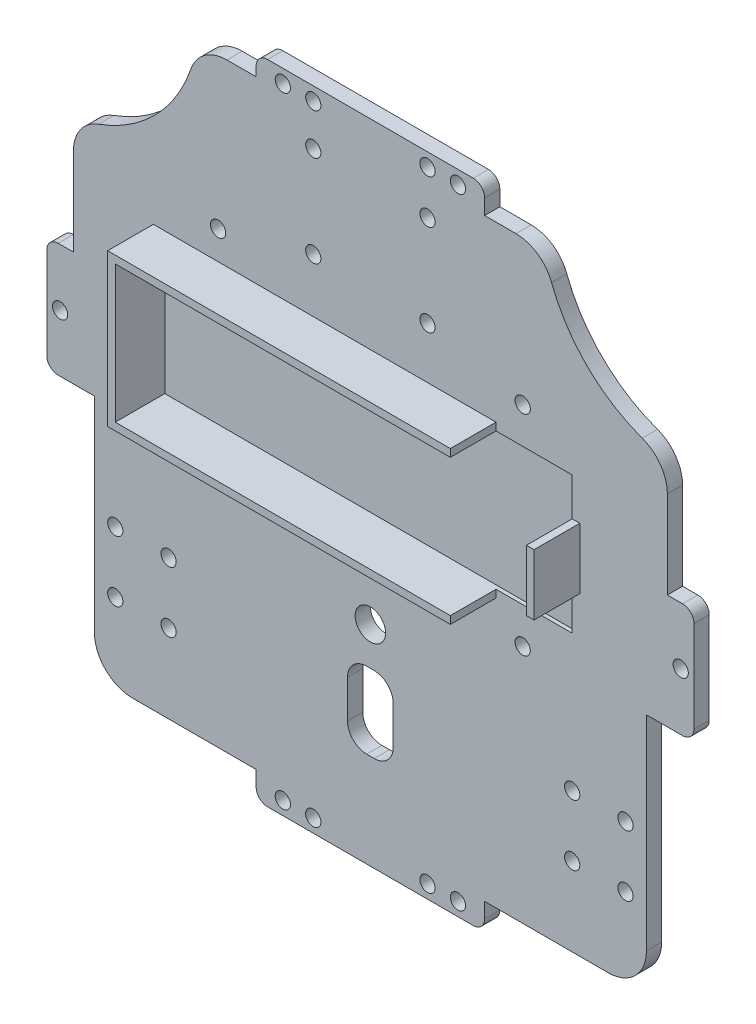
from build123d import *

# Parameters (mm, degrees)
BOSS_EXTRUDE1_DEPTH = 4
SKETCH2_R           = 2
SKETCH2_R_2         = 4
CUT_EXTRUDE1_DEPTH  = 5
BOSS_EXTRUDE2_DEPTH = 12
SKETCH5_W           = 108
SKETCH5_H           = 36
CUT_EXTRUDE3_DEPTH  = 13


with BuildPart() as part:
    # Sketch1 → Boss-Extrude1 (new body)
    with BuildSketch(Plane.XY):
        with BuildLine():
            Line((82, 15), (78, 15))
            Line((78, 15), (78, 37.978728218))
            ThreePointArc((78, 37.978728218), (76.185352772, 43.723290865), (71.4, 47.382982574))
            ThreePointArc((71.4, 47.382982574), (56.923524203, 56.509448815), (47.586109287, 70.850767451))
            ThreePointArc((47.586109287, 70.850767451), (43.91712949, 75.540642349), (38.232636609, 77.313459314))
            Line((38.232636609, 77.313459314), (30, 77.313459314))
            Line((30, 77.313459314), (30, 81.313459314))
            ThreePointArc((30, 81.313459314), (29.121320344, 83.434779658), (27, 84.313459314))
            Line((27, 84.313459314), (-27, 84.313459314))
            ThreePointArc((-27, 84.313459314), (-29.121320344, 83.434779658), (-30, 81.313459314))
            Line((-30, 81.313459314), (-30, 78.861186474))
            Line((-30, 78.861186474), (-37.676235378, 78.861186474))
            ThreePointArc((-37.676235378, 78.861186474), (-43.495271937, 76.993763774), (-47.140988303, 72.08894918))
            ThreePointArc((-47.140988303, 72.08894918), (-56.458737454, 56.975076587), (-71.4, 47.382982574))
            ThreePointArc((-71.4, 47.382982574), (-76.185352772, 43.723290865), (-78, 37.978728218))
            Line((-78, 37.978728218), (-78, 15))
            Line((-78, 15), (-82, 15))
            ThreePointArc((-82, 15), (-84.121320344, 14.121320344), (-85, 12))
            Line((-85, 12), (-85, -12))
            ThreePointArc((-85, -12), (-84.121320344, -14.121320344), (-82, -15))
            Line((-82, -15), (-72.5, -15))
            Line((-72.5, -15), (-72.5, -68.686540686))
            ThreePointArc((-72.5, -68.686540686), (-69.571067812, -75.757608498), (-62.5, -78.686540686))
            Line((-62.5, -78.686540686), (-30, -78.686540686))
            Line((-30, -78.686540686), (-30, -82.686540686))
            ThreePointArc((-30, -82.686540686), (-29.121320344, -84.807861029), (-27, -85.686540686))
            Line((-27, -85.686540686), (27, -85.686540686))
            ThreePointArc((27, -85.686540686), (29.121320344, -84.807861029), (30, -82.686540686))
            Line((30, -82.686540686), (30, -78.686540686))
            Line((30, -78.686540686), (62.5, -78.686540686))
            ThreePointArc((62.5, -78.686540686), (69.571067812, -75.757608498), (72.5, -68.686540686))
            Line((72.5, -68.686540686), (72.5, -15))
            Line((72.5, -15), (82, -15))
            ThreePointArc((82, -15), (84.121320344, -14.121320344), (85, -12))
            Line((85, -12), (85, 12))
            ThreePointArc((85, 12), (84.121320344, 14.121320344), (82, 15))
        make_face()
    extrude(amount=BOSS_EXTRUDE1_DEPTH)

    # Sketch2 → Cut-Extrude1 (cut)
    with BuildSketch(Plane.XY.offset(4)):
        with Locations((81.5, 0)):
            Circle(SKETCH2_R)
        with Locations((-81.5, 0)):
            Circle(SKETCH2_R)
        with Locations((15, 80.813459314)):
            Circle(SKETCH2_R)
        with Locations((23, 80.813459314)):
            Circle(SKETCH2_R)
        with Locations((-23, 80.813459314)):
            Circle(SKETCH2_R)
        with Locations((-15, 80.813459314)):
            Circle(SKETCH2_R)
        with Locations((-23, -82.186540686)):
            Circle(SKETCH2_R)
        with Locations((-15, -82.186540686)):
            Circle(SKETCH2_R)
        with Locations((15, -82.186540686)):
            Circle(SKETCH2_R)
        with Locations((23, -82.186540686)):
            Circle(SKETCH2_R)
        with Locations((67, -42)):
            Circle(SKETCH2_R)
        with Locations((67, -58)):
            Circle(SKETCH2_R)
        with Locations((-40, -15.686540686)):
            Circle(SKETCH2_R)
        with Locations((40, -15.686540686)):
            Circle(SKETCH2_R)
        with Locations((40, 39.313459314)):
            Circle(SKETCH2_R)
        with Locations((-40, 39.313459314)):
            Circle(SKETCH2_R)
        with Locations((0, -30.686540686)):
            Circle(SKETCH2_R_2)
        with Locations((-15, 70.007888798)):
            Circle(SKETCH2_R)
        with Locations((15, 69.313459314)):
            Circle(SKETCH2_R)
        with Locations((-15, 46.007888798)):
            Circle(SKETCH2_R)
        with Locations((15, 45.313459314)):
            Circle(SKETCH2_R)
        with Locations((53, -58)):
            Circle(SKETCH2_R)
        with Locations((53, -42)):
            Circle(SKETCH2_R)
        with Locations((-53, -58)):
            Circle(SKETCH2_R)
        with Locations((-67, -58)):
            Circle(SKETCH2_R)
        with Locations((-67, -42)):
            Circle(SKETCH2_R)
        with Locations((-53, -42)):
            Circle(SKETCH2_R)
        with BuildLine():
            Line((-1, -40.686540686), (1, -40.686540686))
            ThreePointArc((1, -40.686540686), (4.535533906, -42.15100678), (6, -45.686540686))
            Line((6, -45.686540686), (6, -55.686540686))
            ThreePointArc((6, -55.686540686), (4.535533906, -59.222074592), (1, -60.686540686))
            Line((1, -60.686540686), (-1, -60.686540686))
            ThreePointArc((-1, -60.686540686), (-4.535533906, -59.222074592), (-6, -55.686540686))
            Line((-6, -55.686540686), (-6, -45.686540686))
            ThreePointArc((-6, -45.686540686), (-4.535533906, -42.15100678), (-1, -40.686540686))
        make_face()
    extrude(amount=-CUT_EXTRUDE1_DEPTH, mode=Mode.SUBTRACT)

    # Sketch3 → Boss-Extrude2 (add)
    with BuildSketch(Plane.XY.offset(4)):
        Polygon((-57, -8.186540686), (33, -8.186540686), (33, -6.186540686), (53, -6.186540686), (53, 3.813459314), (55, 3.813459314), (55, 19.813459314), (53, 19.813459314), (53, 29.813459314), (33, 29.813459314), (33, 31.813459314), (-57, 31.813459314), align=None)
    extrude(amount=BOSS_EXTRUDE2_DEPTH)

    # Sketch5 → Cut-Extrude3 (cut)
    with BuildSketch(Plane.XY.offset(16)):
        with Locations((-1, 11.813459314)):
            Rectangle(SKETCH5_W, SKETCH5_H)
    extrude(amount=-CUT_EXTRUDE3_DEPTH, mode=Mode.SUBTRACT)


solid = part.part
